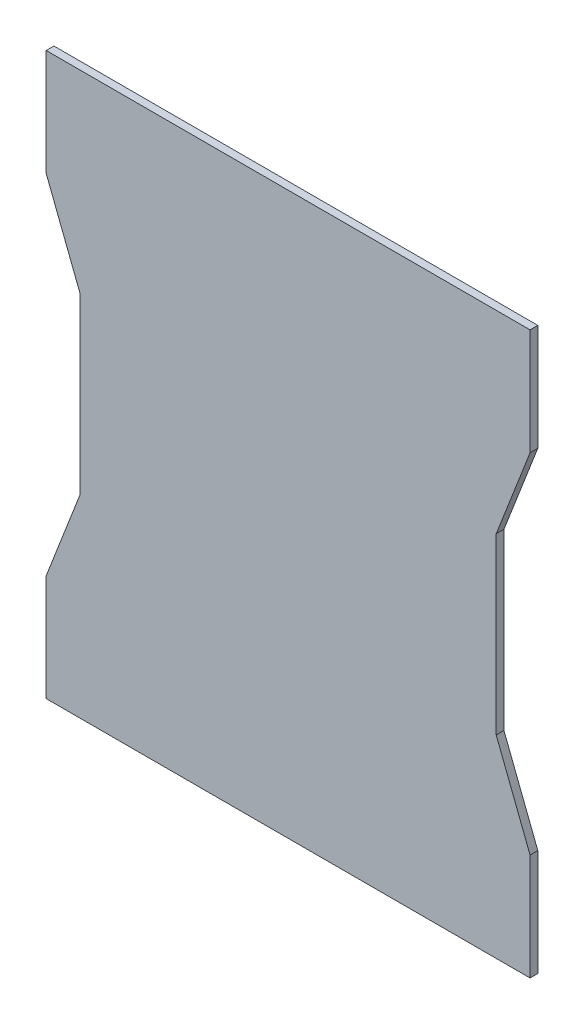
from build123d import *

# Parameters (mm, degrees)
SKETCH_2_W          = 1000
SKETCH_2_H          = 1160
EXTRUDE_1_DEPTH     = 16
CUT_EXTRUDE_1_DEPTH = 766.934723067


with BuildPart() as part:
    # 草图2 → 凸台-拉伸1 (new body)
    with BuildSketch(Plane.XY):
        Rectangle(SKETCH_2_W, SKETCH_2_H)
    extrude(amount=EXTRUDE_1_DEPTH)

    # 草图4 → 切除-拉伸1 (cut, through all)
    with BuildSketch(Plane(origin=(0, 0, 0), x_dir=(-1, 0, 0), z_dir=(0, 0, -1))):
        Polygon((-500, 360), (-430, 180), (-430, -180), (-500, -360), align=None)
        Polygon((430, 180), (430, -180), (500, -360), (500, 360), align=None)
    extrude(amount=-CUT_EXTRUDE_1_DEPTH, mode=Mode.SUBTRACT)


solid = part.part
